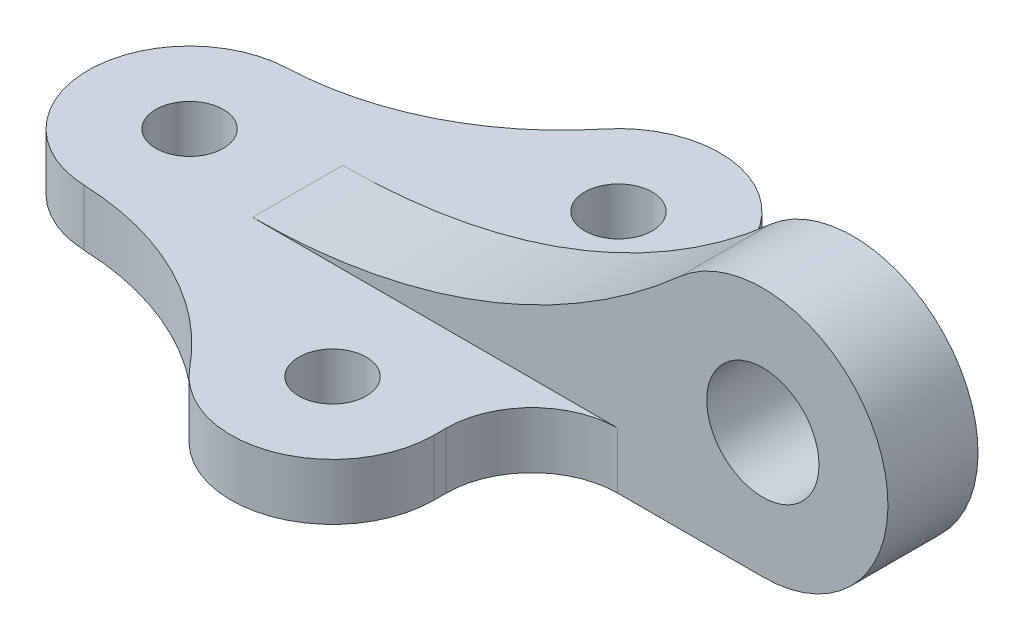
from build123d import *

# Parameters (mm, degrees)
SKETCH2_R           = 5.9944
BOSS_EXTRUDE1_DEPTH = 5.0038
SKETCH3_R           = 9.9695
BOSS_EXTRUDE2_DEPTH = 8.001
FILLET1_R           = 15.24


with BuildPart() as part:
    # Sketch2 → Boss-Extrude1 (new, symmetric)
    with BuildSketch(Plane(origin=(0, 0, 0), x_dir=(1, 0, 0), z_dir=(0, 1, 0))):
        with BuildLine():
            Line((68.834, 25.4), (68.834, -25.4))
            ThreePointArc((68.834, -25.4), (56.830149579, -42.395953991), (36.798683148, -36.76610234))
            ThreePointArc((36.798683148, -36.76610234), (20.076804637, -23.346390726), (-0.69209176, -18.020714886))
            ThreePointArc((-0.69209176, -18.020714886), (-18.034, 0), (-0.69209176, 18.020714886))
            ThreePointArc((-0.69209176, 18.020714886), (20.076804637, 23.346390726), (36.798683148, 36.76610234))
            ThreePointArc((36.798683148, 36.76610234), (56.830149579, 42.395953991), (68.834, 25.4))
        make_face()
        with Locations(Location((0, 0, 0), (0, 0, 270))):
            Circle(SKETCH2_R, mode=Mode.SUBTRACT)
        with Locations(Location((50.8, 25.4, 0), (0, 0, 270))):
            Circle(SKETCH2_R, mode=Mode.SUBTRACT)
        with Locations(Location((50.8, -25.4, 0), (0, 0, 270))):
            Circle(SKETCH2_R, mode=Mode.SUBTRACT)
    extrude(amount=BOSS_EXTRUDE1_DEPTH, both=True)

    # Sketch3 → Boss-Extrude2 (add, symmetric)
    with BuildSketch(Plane.XY):
        with BuildLine():
            Line((109.855, -5.0038), (68.834, -5.0038))
            Line((68.834, -5.0038), (68.834, 5.0038))
            Line((68.834, 5.0038), (36.798683148, 5.0038))
            Line((36.798683148, 5.0038), (19.200610133, 5.0038))
            ThreePointArc((19.200610133, 5.0038), (59.795544448, 12.455583787), (95.097308626, 33.839297674))
            ThreePointArc((95.097308626, 33.839297674), (130.631042041, 25.11465945), (109.855, -5.0038))
        make_face()
        with Locations((109.855, 17.2212)):
            Circle(SKETCH3_R, mode=Mode.SUBTRACT)
    extrude(amount=BOSS_EXTRUDE2_DEPTH, both=True)

    # Fillet1
    fillet1_edges = [part.edges().sort_by_distance(p)[0] for p in [
        (68.834, 0, 8.001),
        (68.834, 0, -8.001),
    ]]
    fillet(fillet1_edges, radius=FILLET1_R)


solid = part.part
